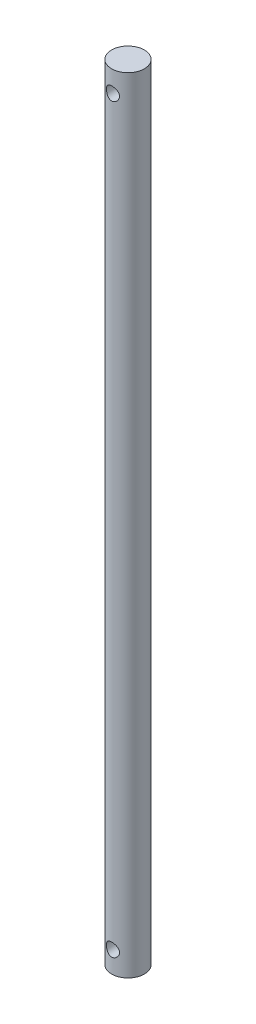
from build123d import *

# Parameters (mm, degrees)
CROQUIS1_R                 = 5
SALIENTE_EXTRUIR1_DEPTH    = 339
CROQUIS2_R                 = 6.894742802
CORTAR_EXTRUIR1_DEPTH      = 99.5
CORTAR_EXTRUIR2_DEPTH      = 10
CORTAR_EXTRUIR2_DEPTH_BACK = 10
CROQUIS3_R                 = 2
CORTAR_EXTRUIR3_DEPTH      = 10
CORTAR_EXTRUIR3_DEPTH_BACK = 10
CROQUIS4_R                 = 2


with BuildPart() as part:
    # Croquis1 → Saliente-Extruir1 (new body)
    with BuildSketch(Plane(origin=(0, 0, 0), x_dir=(1, 0, 0), z_dir=(0, 1, 0))):
        Circle(CROQUIS1_R)
    extrude(amount=SALIENTE_EXTRUIR1_DEPTH)

    # Croquis2 → Cortar-Extruir1 (cut)
    with BuildSketch(Plane(origin=(0, 339, 0), x_dir=(1, 0, 0), z_dir=(0, 1, 0))):
        Circle(CROQUIS2_R)
    extrude(amount=-CORTAR_EXTRUIR1_DEPTH, mode=Mode.SUBTRACT)

    # Croquis3 → Cortar-Extruir2 (cut, two sides: drawn at the far end of the back side and taken through both)
    with BuildSketch(Plane.XY.offset(-CORTAR_EXTRUIR2_DEPTH_BACK)):
        with Locations((0, 6.5)):
            Circle(CROQUIS3_R)
    extrude(amount=CORTAR_EXTRUIR2_DEPTH + CORTAR_EXTRUIR2_DEPTH_BACK, mode=Mode.SUBTRACT)

    # Croquis4 → Cortar-Extruir3 (cut, two sides: drawn at the far end of the back side and taken through both)
    with BuildSketch(Plane.XY.offset(-CORTAR_EXTRUIR3_DEPTH_BACK)):
        with Locations((0, 233)):
            Circle(CROQUIS4_R)
    extrude(amount=CORTAR_EXTRUIR3_DEPTH + CORTAR_EXTRUIR3_DEPTH_BACK, mode=Mode.SUBTRACT)


solid = part.part
